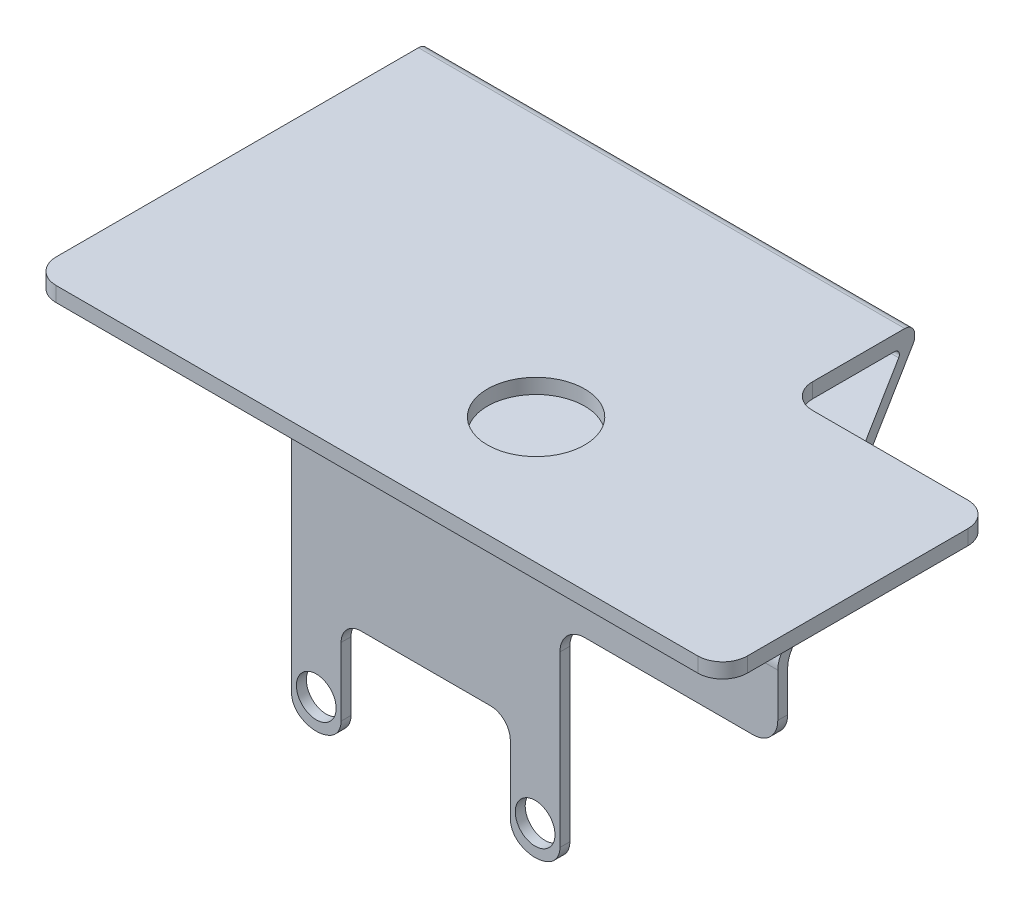
from build123d import *

# Parameters (mm, degrees)
SKETCH1_R           = 4.896847049
BOSS_EXTRUDE1_DEPTH = 1.5
BOSS_EXTRUDE4_DEPTH = 49
FILLET1_R           = 1
FILLET2_R           = 0.5
SKETCH3_R           = 2
BOSS_EXTRUDE6_DEPTH = 1
FILLET3_R           = 2.5
FILLET4_R           = 2.5


with BuildPart() as part:
    # Sketch1 → Boss-Extrude1 (new body)
    with BuildSketch(Plane(origin=(0, 0, 0), x_dir=(1, 0, 0), z_dir=(0, 1, 0))):
        with BuildLine():
            Line((-32.322023461, -13.602352914), (32.322023461, -13.602352914))
            ThreePointArc((32.322023461, -13.602352914), (34.089790414, -12.870119867), (34.822023461, -11.102352914))
            Line((34.822023461, -11.102352914), (34.822023461, 11.102352914))
            ThreePointArc((34.822023461, 11.102352914), (34.089790414, 12.870119867), (32.322023461, 13.602352914))
            Line((32.322023461, 13.602352914), (16.677976539, 13.602352914))
            ThreePointArc((16.677976539, 13.602352914), (14.910209586, 14.334585961), (14.177976539, 16.102352914))
            Line((14.177976539, 16.102352914), (14.177976539, 26.397647086))
            Line((14.177976539, 26.397647086), (-32.322023461, 26.397647086))
            Line((-32.322023461, 26.397647086), (-34.822023461, 26.397647086))
            Line((-34.822023461, 26.397647086), (-34.822023461, 23.897647086))
            Line((-34.822023461, 23.897647086), (-34.822023461, 13.602352914))
            Line((-34.822023461, 13.602352914), (-34.822023461, -11.102352914))
            Line((-34.822023461, -11.102352914), (-34.822023461, -13.602352914))
            Line((-34.822023461, -13.602352914), (-32.322023461, -13.602352914))
        make_face()
        with Locations(Location((3.322023461, -0.897647086, 0), (0, 0, 270))):
            Circle(SKETCH1_R, mode=Mode.SUBTRACT)
    extrude(amount=BOSS_EXTRUDE1_DEPTH)

    # Sketch2 → Boss-Extrude4 (add)
    with BuildSketch(Plane(origin=(14.177976539, 0, 0), x_dir=(0, 0, -1), z_dir=(1, 0, 0))):
        with BuildLine():
            Line((25.233954828, 0), (12.954018608, -20.634041328))
            ThreePointArc((12.954018608, -20.634041328), (12.691872074, -21.249569549), (12.602352914, -21.912579441))
            Line((12.602352914, -21.912579441), (12.602352914, -28.802677945))
            Line((12.602352914, -28.802677945), (13.602352914, -28.802677945))
            Line((13.602352914, -28.802677945), (13.602352914, -22.187632402))
            ThreePointArc((13.602352914, -22.187632402), (13.691872074, -21.52462251), (13.954018608, -20.909094288))
            Line((13.954018608, -20.909094288), (26.397647086, 0))
            Line((26.397647086, 0), (25.233954828, 0))
        make_face()
    extrude(amount=-BOSS_EXTRUDE4_DEPTH)

    # Fillet1
    fillet1_edges = [part.edges().sort_by_distance(p)[0] for p in [
        (-10.322023461, 0, -26.397647086),
        (-10.322023461, 1.5, -26.397647086),
    ]]
    fillet(fillet1_edges, radius=FILLET1_R)

    # Fillet2
    fillet2_edges = [part.edges().sort_by_distance(p)[0] for p in [
        (-10.322023461, 0, -25.233954828),
    ]]
    fillet(fillet2_edges, radius=FILLET2_R)

    # Sketch3 → Boss-Extrude6 (add)
    with BuildSketch(Plane.XY.offset(-12.602352914)):
        with BuildLine():
            Line((-27.822023461, -39.5), (-14.772023461, -39.5))
            ThreePointArc((-14.772023461, -39.5), (-13.357809898, -40.085786438), (-12.772023461, -41.5))
            Line((-12.772023461, -41.5), (-12.772023461, -48.366025404))
            ThreePointArc((-12.772023461, -48.366025404), (-12.504074268, -49.366025404), (-11.772023461, -50.098076211))
            ThreePointArc((-11.772023461, -50.098076211), (-10.272023461, -50.5), (-8.772023461, -50.098076211))
            ThreePointArc((-8.772023461, -50.098076211), (-8.039972653, -49.366025404), (-7.772023461, -48.366025404))
            Line((-7.772023461, -48.366025404), (-7.772023461, -39.5))
            Line((-7.772023461, -39.5), (-7.772023461, -28.802677945))
            Line((-7.772023461, -28.802677945), (-34.822023461, -28.802677945))
            Line((-34.822023461, -28.802677945), (-34.822023461, -39.5))
            Line((-34.822023461, -39.5), (-34.822023461, -48.366025404))
            ThreePointArc((-34.822023461, -48.366025404), (-34.554074268, -49.366025404), (-33.822023461, -50.098076211))
            ThreePointArc((-33.822023461, -50.098076211), (-32.322023461, -50.5), (-30.822023461, -50.098076211))
            ThreePointArc((-30.822023461, -50.098076211), (-30.089972653, -49.366025404), (-29.822023461, -48.366025404))
            Line((-29.822023461, -48.366025404), (-29.822023461, -41.5))
            ThreePointArc((-29.822023461, -41.5), (-29.236237023, -40.085786438), (-27.822023461, -39.5))
        make_face()
        with Locations((-32.322023461, -47.5)):
            Circle(SKETCH3_R, mode=Mode.SUBTRACT)
        with Locations((-10.272023461, -47.5)):
            Circle(SKETCH3_R, mode=Mode.SUBTRACT)
    extrude(amount=-BOSS_EXTRUDE6_DEPTH)

    # Fillet3
    fillet3_edges = [part.edges().sort_by_distance(p)[0] for p in [
        (14.177976539, -28.802677945, -13.102352914),
        (-7.772023461, -28.802677945, -13.102352914),
    ]]
    fillet(fillet3_edges, radius=FILLET3_R)

    # Fillet4
    fillet4_edges = [part.edges().sort_by_distance(p)[0] for p in [
        (-34.822023461, 0.75, 13.602352914),
    ]]
    fillet(fillet4_edges, radius=FILLET4_R)


solid = part.part
